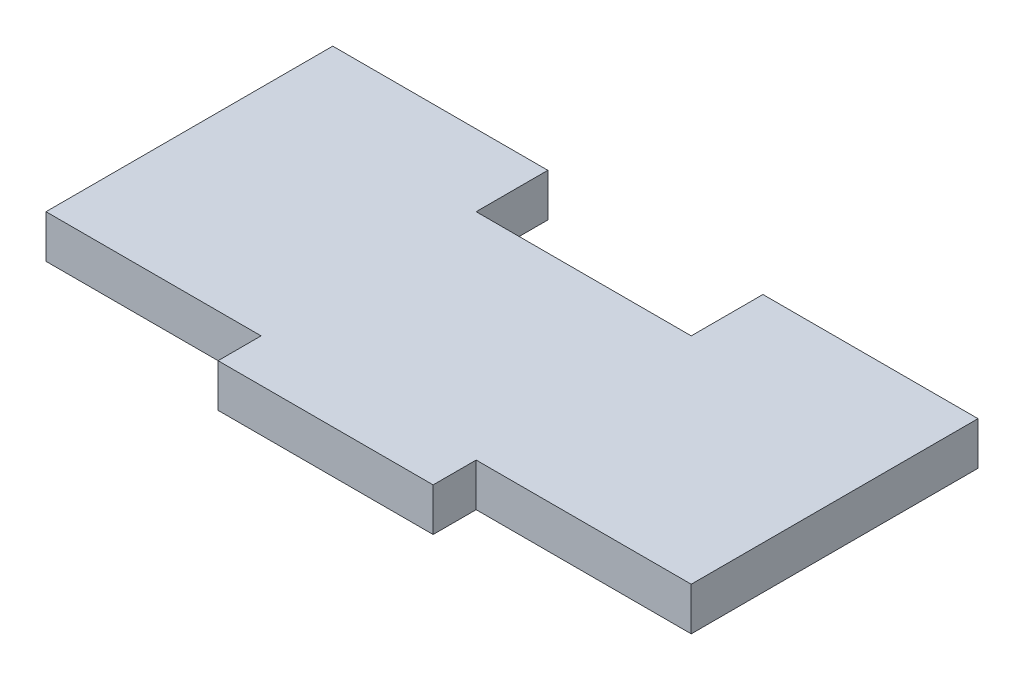
from build123d import *

# Parameters (mm, degrees)
SKETCH2_W           = 45
SKETCH2_H           = 23
BOSS_EXTRUDE1_DEPTH = 3
SKETCH3_W           = 15
SKETCH3_H           = 5
CUT_FOR_PINS_DEPTH  = 3
SKETCH6_W           = 15
SKETCH6_H           = 3
CUT_EXTRUDE3_DEPTH  = 3


with BuildPart() as part:
    # Sketch2 → Boss-Extrude1 (new body)
    with BuildSketch(Plane(origin=(0, 0, 0), x_dir=(1, 0, 0), z_dir=(0, 1, 0))):
        Rectangle(SKETCH2_W, SKETCH2_H)
    extrude(amount=BOSS_EXTRUDE1_DEPTH)

    # Sketch3 → cut for pins (cut)
    with BuildSketch(Plane(origin=(0, 3, 0), x_dir=(1, 0, 0), z_dir=(0, 1, 0))):
        with Locations((0, 9)):
            Rectangle(SKETCH3_W, SKETCH3_H)
    extrude(amount=-CUT_FOR_PINS_DEPTH, mode=Mode.SUBTRACT)

    # Sketch6 → Cut-Extrude3 (cut)
    with BuildSketch(Plane(origin=(0, 3, 0), x_dir=(1, 0, 0), z_dir=(0, 1, 0))):
        with Locations((-15, -10)):
            Rectangle(SKETCH6_W, SKETCH6_H)
        with Locations((15, -10)):
            Rectangle(SKETCH6_W, SKETCH6_H)
    extrude(amount=-CUT_EXTRUDE3_DEPTH, mode=Mode.SUBTRACT)


solid = part.part
